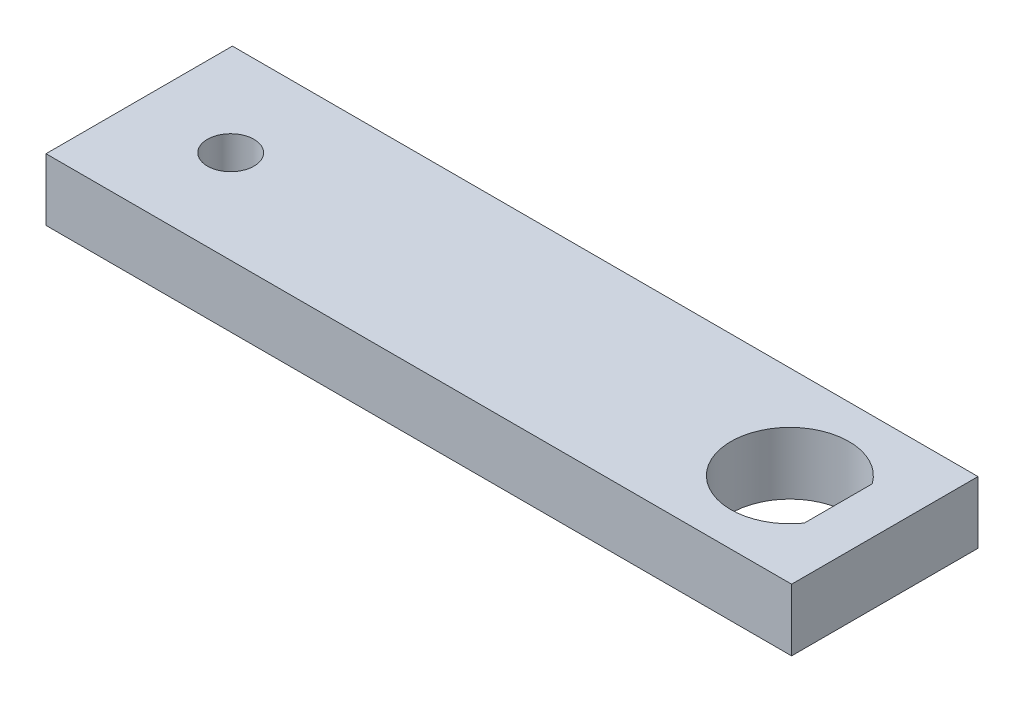
from build123d import *

# Parameters (mm, degrees)
IZIM1_W                     = 76.2
IZIM1_H                     = 19.05
IZIM1_R                     = 2.38
Y_KSEKLIK_EKSTR_ZYON1_DEPTH = 6.35


with BuildPart() as part:
    # Çizim1 → Yükseklik-Ekstrüzyon1 (new body)
    with BuildSketch(Plane(origin=(0, 0, 0), x_dir=(1, 0, 0), z_dir=(0, 1, 0))):
        with Locations((-3.015107914, 6.715467626)):
            Rectangle(IZIM1_W, IZIM1_H)
        with Locations(Location((-31.765107914, 6.715467626, 0), (0, 0, 270))):
            Circle(IZIM1_R, mode=Mode.SUBTRACT)
        with BuildLine():
            Line((30.324892086, 10.182112257), (30.324892086, 3.248822995))
            ThreePointArc((30.324892086, 3.248822995), (19.349892086, 6.715467626), (30.324892086, 10.182112257))
        make_face(mode=Mode.SUBTRACT)
    extrude(amount=Y_KSEKLIK_EKSTR_ZYON1_DEPTH)


solid = part.part
